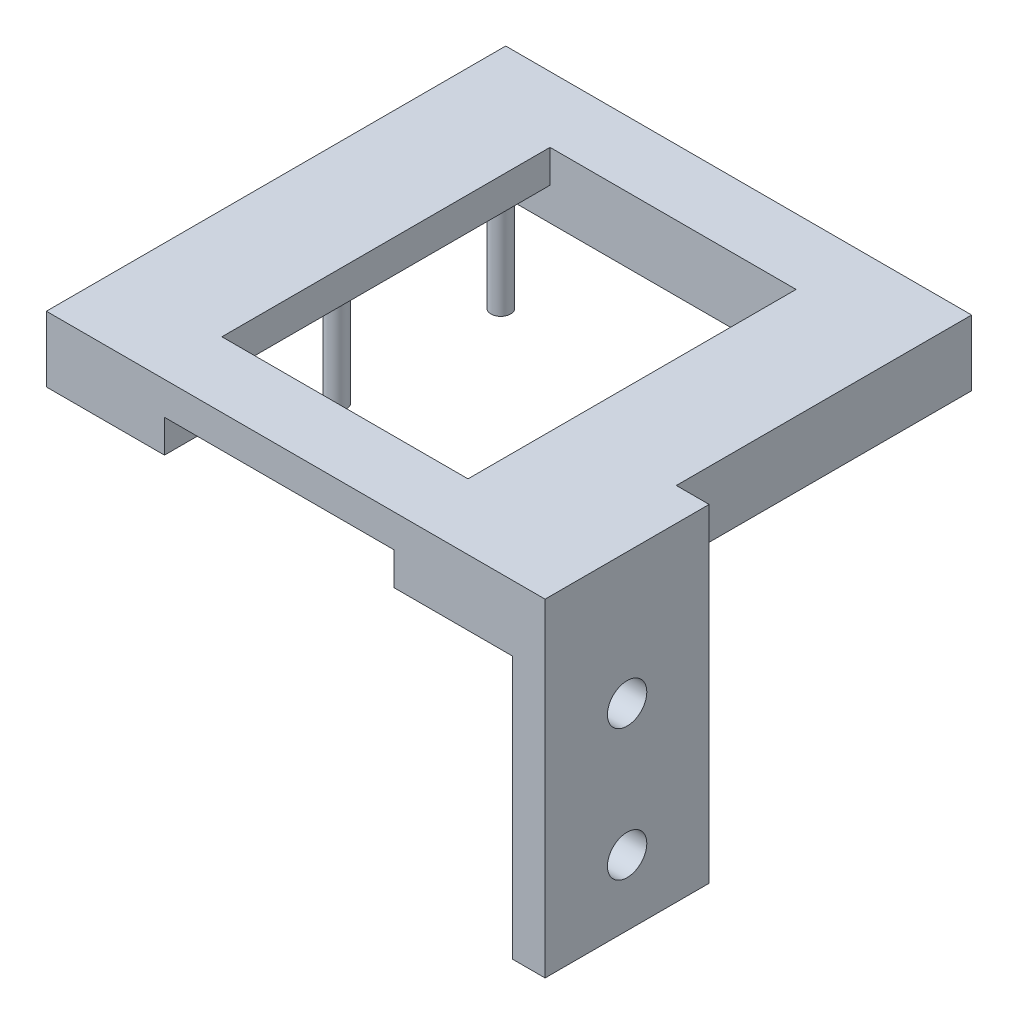
from build123d import *

# Parameters (mm, degrees)
BOSS_EXTRUDE1_DEPTH = 2.54
SKETCH4_W           = 36.068
SKETCH4_H           = 35.56
BOSS_EXTRUDE2_DEPTH = 2.54
SKETCH5_W           = 19.05
SKETCH5_H           = 25.4
CUT_EXTRUDE1_DEPTH  = 44.540075149
SKETCH7_R           = 0.762
BOSS_EXTRUDE3_DEPTH = 7.62
SKETCH9_W           = 12.7
SKETCH9_H           = 25.4
SKETCH9_R           = 1.524
BOSS_EXTRUDE4_DEPTH = 2.54


with BuildPart() as part:
    # Sketch1 → Boss-Extrude1 (new body)
    with BuildSketch(Plane(origin=(0, 0, 0), x_dir=(1, 0, 0), z_dir=(0, 1, 0))):
        Polygon((-5.08, 30.48), (30.988, 30.48), (30.988, -5.08), (21.844, -5.08), (21.844, 0), (25.908, 0), (25.908, 25.4), (0, 25.4), (0, 0), (4.064, 0), (4.064, -5.08), (-5.08, -5.08), align=None)
    extrude(amount=BOSS_EXTRUDE1_DEPTH)

    # Sketch4 → Boss-Extrude2 (add)
    with BuildSketch(Plane(origin=(0, 2.54, 0), x_dir=(1, 0, 0), z_dir=(0, 1, 0))):
        with Locations((12.954, 12.7)):
            Rectangle(SKETCH4_W, SKETCH4_H)
    extrude(amount=BOSS_EXTRUDE2_DEPTH)

    # Sketch5 → Cut-Extrude1 (cut, through all)
    with BuildSketch(Plane.XZ.offset(-2.54)):
        with Locations((12.954, -12.7)):
            Rectangle(SKETCH5_W, SKETCH5_H)
    extrude(amount=-CUT_EXTRUDE1_DEPTH, mode=Mode.SUBTRACT)

    # Sketch7 → Boss-Extrude3 (add)
    with BuildSketch(Plane.XZ.offset(-2.54)):
        with Locations(Location((2.159, -10.16, 0), (0, 0, 90))):
            Circle(SKETCH7_R)
        with Locations(Location((2.159, -22.86, 0), (0, 0, 90))):
            Circle(SKETCH7_R)
        with Locations(Location((23.749, -10.16, 0), (0, 0, 90))):
            Circle(SKETCH7_R)
        with Locations(Location((23.749, -22.86, 0), (0, 0, 90))):
            Circle(SKETCH7_R)
    extrude(amount=BOSS_EXTRUDE3_DEPTH)

    # Sketch9 → Boss-Extrude4 (add)
    with BuildSketch(Plane(origin=(30.988, 0, 0), x_dir=(0, 0, -1), z_dir=(1, 0, 0))):
        with Locations((1.27, -7.62)):
            Rectangle(SKETCH9_W, SKETCH9_H)
        with Locations((1.27, -5.08)):
            Circle(SKETCH9_R, mode=Mode.SUBTRACT)
        with Locations((1.27, -15.24)):
            Circle(SKETCH9_R, mode=Mode.SUBTRACT)
    extrude(amount=BOSS_EXTRUDE4_DEPTH)


solid = part.part
